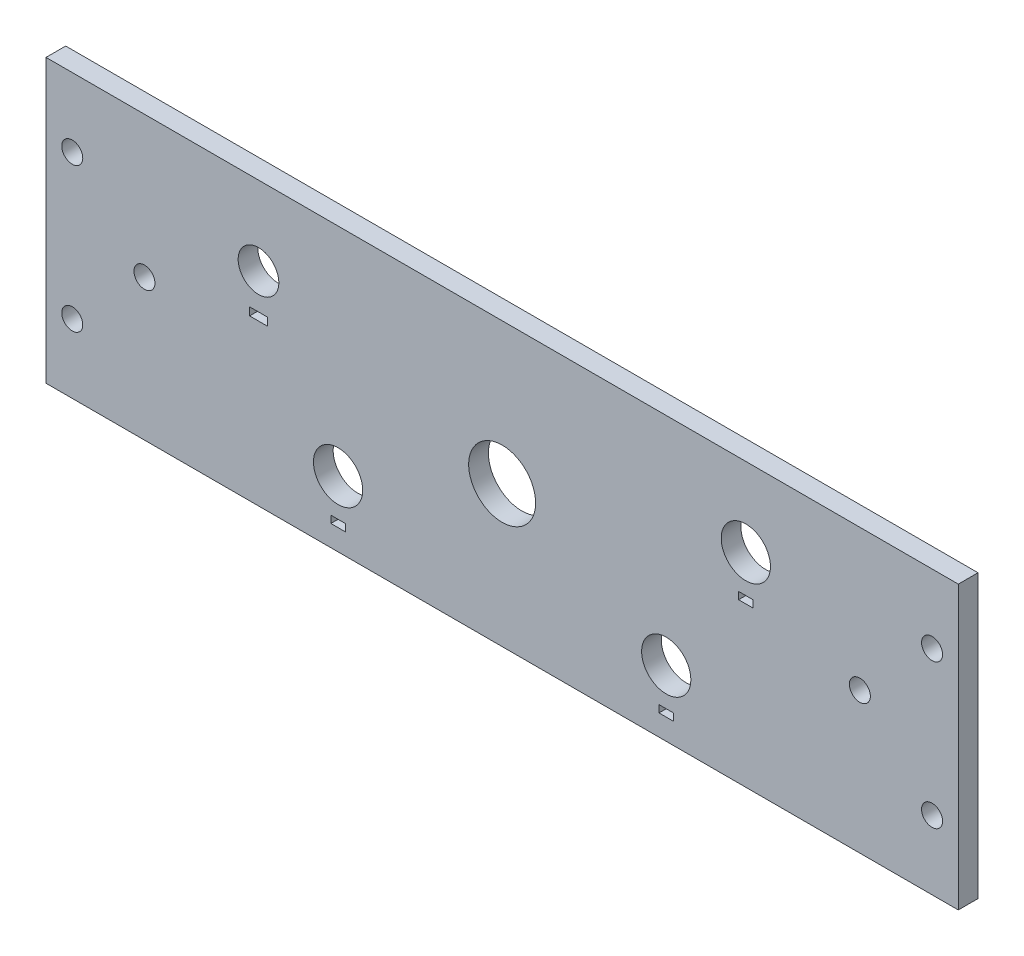
from build123d import *

# Parameters (mm, degrees)
SKETCH1_W           = 139
SKETCH1_H           = 43
SKETCH1_R           = 3.1
SKETCH1_R_2         = 3.75
SKETCH1_R_3         = 1.6
SKETCH1_R_4         = 5.1
SKETCH1_W_2         = 2.7
SKETCH1_H_2         = 1.2
SKETCH1_W_3         = 2.2
SKETCH1_H_3         = 1.1
BOSS_EXTRUDE1_DEPTH = 3


with BuildPart() as part:
    # Sketch1 → Boss-Extrude1 (new body)
    with BuildSketch(Plane.XY):
        with Locations((69.5, 21.5)):
            Rectangle(SKETCH1_W, SKETCH1_H)
        with Locations((32.375644347, 31)):
            Circle(SKETCH1_R, mode=Mode.SUBTRACT)
        with Locations((94.5, 10)):
            Circle(SKETCH1_R_2, mode=Mode.SUBTRACT)
        with Locations((4, 32.5)):
            Circle(SKETCH1_R_3, mode=Mode.SUBTRACT)
        with Locations((135, 32.5)):
            Circle(SKETCH1_R_3, mode=Mode.SUBTRACT)
        with Locations((135, 10.5)):
            Circle(SKETCH1_R_3, mode=Mode.SUBTRACT)
        with Locations((4, 10.5)):
            Circle(SKETCH1_R_3, mode=Mode.SUBTRACT)
        with Locations((69.5, 21.5)):
            Circle(SKETCH1_R_4, mode=Mode.SUBTRACT)
        with Locations((15, 21.5)):
            Circle(SKETCH1_R_3, mode=Mode.SUBTRACT)
        with Locations((124, 21.5)):
            Circle(SKETCH1_R_3, mode=Mode.SUBTRACT)
        with Locations(Location((44.5, 10, 0), (0, 0, 180))):
            Circle(SKETCH1_R_2, mode=Mode.SUBTRACT)
        with Locations((106.624355653, 31)):
            Circle(SKETCH1_R_2, mode=Mode.SUBTRACT)
        with Locations((32.375644347, 25)):
            Rectangle(SKETCH1_W_2, SKETCH1_H_2, mode=Mode.SUBTRACT)
        with Locations((94.5, 3.75)):
            Rectangle(SKETCH1_W_3, SKETCH1_H_3, mode=Mode.SUBTRACT)
        with Locations((44.5, 3.75)):
            Rectangle(SKETCH1_W_3, SKETCH1_H_3, mode=Mode.SUBTRACT)
        with Locations((106.624355653, 24.75)):
            Rectangle(SKETCH1_W_3, SKETCH1_H_3, mode=Mode.SUBTRACT)
    extrude(amount=BOSS_EXTRUDE1_DEPTH)


solid = part.part
